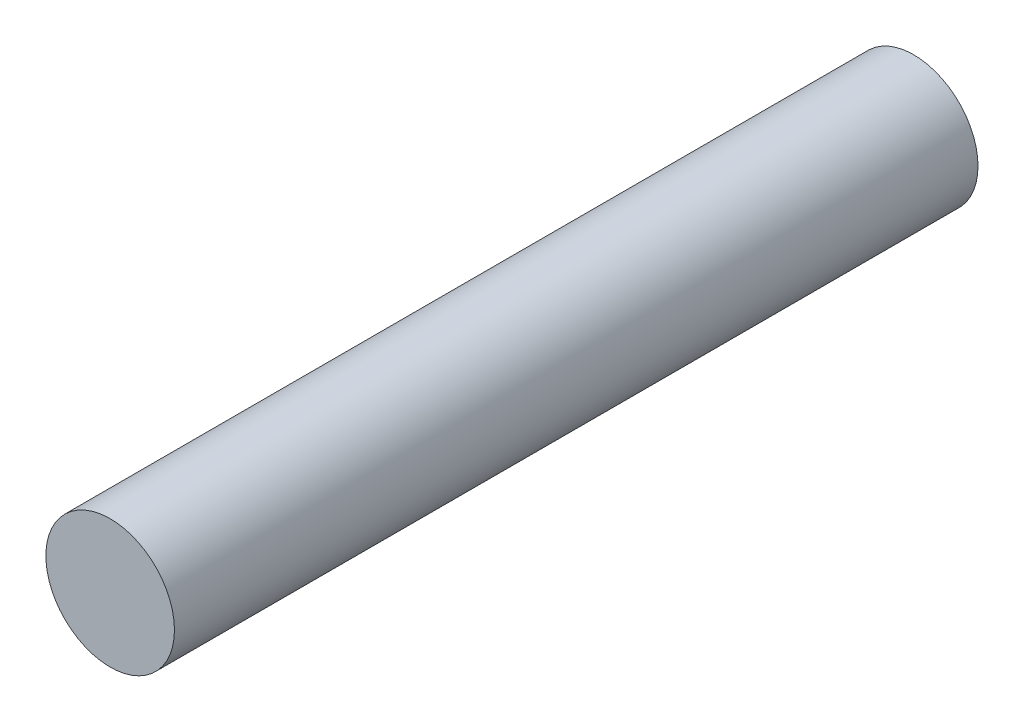
from build123d import *

# Parameters (mm, degrees)
SKETCH1_R           = 14
BOSS_EXTRUDE1_DEPTH = 175


with BuildPart() as part:
    # Sketch1 → Boss-Extrude1 (new body)
    with BuildSketch(Plane.XY):
        Circle(SKETCH1_R)
    extrude(amount=BOSS_EXTRUDE1_DEPTH)


solid = part.part
